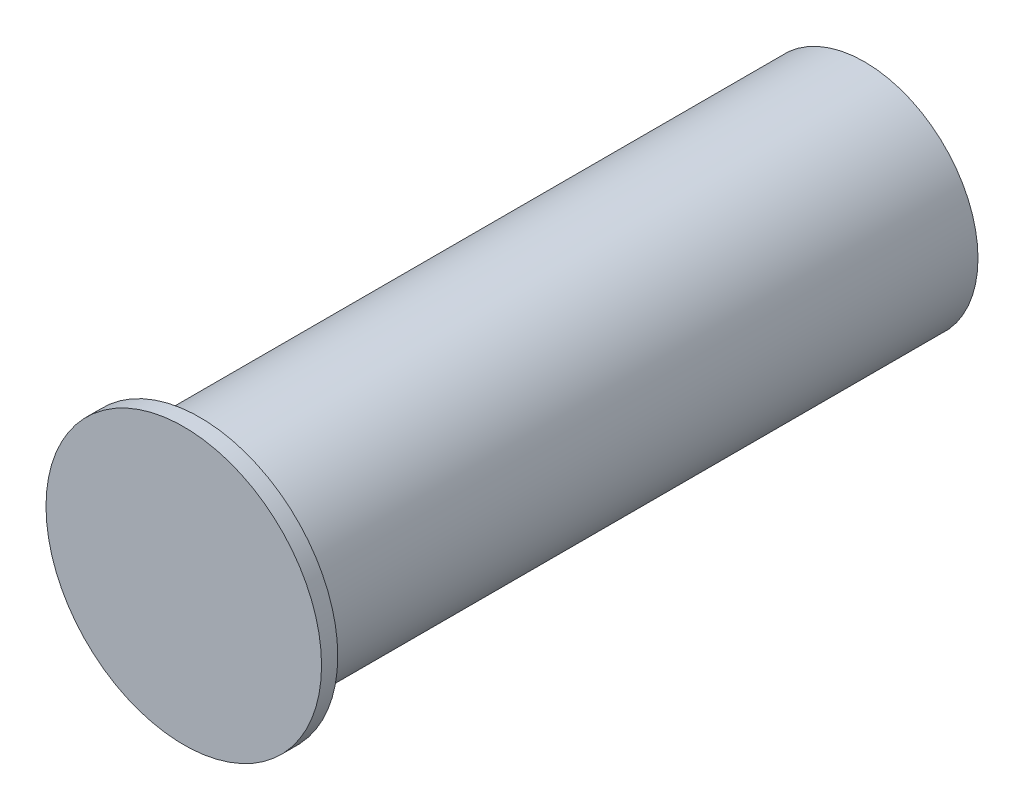
from build123d import *

# Parameters (mm, degrees)
SKETCH1_R           = 1.778
BOSS_EXTRUDE1_DEPTH = 10.414
SKETCH2_R           = 2.159
BOSS_EXTRUDE2_DEPTH = 0.254


with BuildPart() as part:
    # Sketch1 → Boss-Extrude1 (new body)
    with BuildSketch(Plane.XY):
        Circle(SKETCH1_R)
    extrude(amount=-BOSS_EXTRUDE1_DEPTH)

    # Sketch2 → Boss-Extrude2 (add)
    with BuildSketch(Plane.XY):
        Circle(SKETCH2_R)
    extrude(amount=BOSS_EXTRUDE2_DEPTH)


solid = part.part
